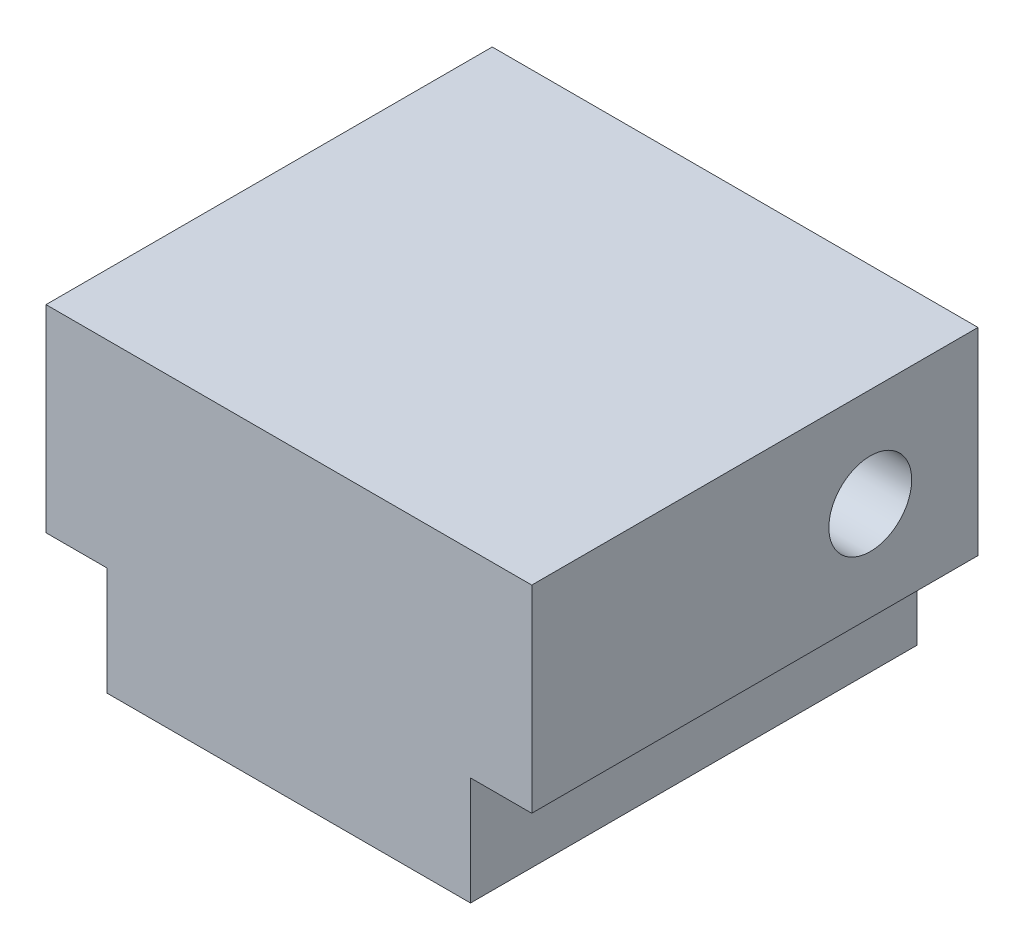
from build123d import *

# Parameters (mm, degrees)
SKETCH1_W           = 76.2
SKETCH1_H           = 70
BOSS_EXTRUDE1_DEPTH = 31
SKETCH2_R           = 6.5
CUT_EXTRUDE1_DEPTH  = 90.400447426
SKETCH4_W           = 56.989038302
SKETCH4_H           = 70
BOSS_EXTRUDE2_DEPTH = 17


with BuildPart() as part:
    # Sketch1 → Boss-Extrude1 (new body)
    with BuildSketch(Plane(origin=(0, 0, 0), x_dir=(1, 0, 0), z_dir=(0, 1, 0))):
        Rectangle(SKETCH1_W, SKETCH1_H)
    extrude(amount=BOSS_EXTRUDE1_DEPTH)

    # Sketch2 → Cut-Extrude1 (cut, through all)
    with BuildSketch(Plane(origin=(38.1, 0, 0), x_dir=(0, 0, -1), z_dir=(1, 0, 0))):
        with Locations((18.1, 15.5)):
            Circle(SKETCH2_R)
    extrude(amount=-CUT_EXTRUDE1_DEPTH, mode=Mode.SUBTRACT)

    # Sketch4 → Boss-Extrude2 (add)
    with BuildSketch(Plane.XZ):
        Rectangle(SKETCH4_W, SKETCH4_H)
    extrude(amount=BOSS_EXTRUDE2_DEPTH)


solid = part.part
